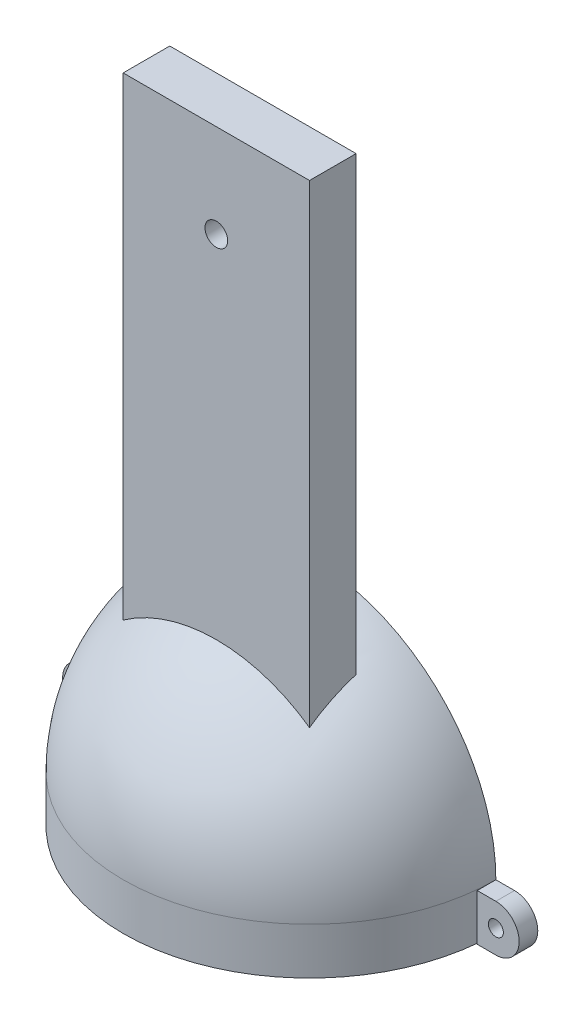
from build123d import *

# Parameters (mm, degrees)
REVOLVE2_ANGLE        = 90
BOSS_EXTRUDE2_DEPTH   = 5
BOSS_EXTRUDE3_DEPTH   = 2
BOSS_EXTRUDE3_2_DEPTH = 2
BOSS_EXTRUDE4_START   = 14.142136
SKETCH10_W            = 20
SKETCH10_H            = 5
BOSS_EXTRUDE4_DEPTH   = 50.857864
SKETCH11_R            = 5
BOSS_EXTRUDE6_DEPTH   = 5
SKETCH12_R            = 1.22
SKETCH12_R_2          = 0.805
CUT_EXTRUDE1_DEPTH    = 10


with BuildPart() as part:
    # Sketch1 → Revolve2 (revolve)
    with BuildSketch(Plane.XY):
        with BuildLine():
            Line((-20, 0), (-15, 0))
            ThreePointArc((-15, 0), (0, 15), (15, 0))
            Line((15, 0), (20, 0))
            ThreePointArc((20, 0), (0, 20), (-20, 0))
        make_face()
    revolve(axis=Axis((10, 0, 0), (1, 0, 0)), revolution_arc=REVOLVE2_ANGLE)

    # Sketch3 → Boss-Extrude2 (add)
    with BuildSketch(Plane.XZ):
        with BuildLine():
            Line((-20, 0), (-10, 0))
            ThreePointArc((-10, 0), (0, 10), (10, 0))
            Line((10, 0), (20, 0))
            ThreePointArc((20, 0), (0, 20), (-20, 0))
        make_face()
    extrude(amount=BOSS_EXTRUDE2_DEPTH)

    # Sketch10 → Boss-Extrude4 (add)
    with BuildSketch(Plane(origin=(0, 0, 0), x_dir=(1, 0, 0), z_dir=(0, 1, 0)).offset(BOSS_EXTRUDE4_START)):
        with Locations((0, -7.5)):
            Rectangle(SKETCH10_W, SKETCH10_H)
    extrude(amount=BOSS_EXTRUDE4_DEPTH)

    # Sketch11 → Boss-Extrude6 (add)
    with BuildSketch(Plane(origin=(0, 0, 5), x_dir=(-1, 0, 0), z_dir=(0, 0, -1))):
        with Locations(Location((0, 55, 0), (0, 0, 180))):
            Circle(SKETCH11_R)
    extrude(amount=BOSS_EXTRUDE6_DEPTH)


with BuildPart() as body_2:
    # Sketch5 → Boss-Extrude3 (new body)
    with BuildSketch(Plane(origin=(0, 0, 0), x_dir=(-1, 0, 0), z_dir=(0, 0, -1))):
        with BuildLine():
            Line((-22, 0), (-20, 0))
            Line((-20, 0), (-20, -5))
            Line((-20, -5), (-22, -5))
            ThreePointArc((-22, -5), (-24.5, -2.5), (-22, 0))
        make_face()
    extrude(amount=-BOSS_EXTRUDE3_DEPTH)


with BuildPart() as body_3:
    # Sketch5 → Boss-Extrude3 2 (new body)
    with BuildSketch(Plane(origin=(0, 0, 0), x_dir=(-1, 0, 0), z_dir=(0, 0, -1))):
        with BuildLine():
            Line((22, -5), (20, -5))
            Line((20, -5), (20, 0))
            Line((20, 0), (22, 0))
            ThreePointArc((22, 0), (24.5, -2.5), (22, -5))
        make_face()
    extrude(amount=-BOSS_EXTRUDE3_2_DEPTH)


with BuildPart() as cut_extrude1_tool:
    # Sketch12 → Cut-Extrude1 (new body)
    with BuildSketch(Plane(origin=(0, 0, 0), x_dir=(-1, 0, 0), z_dir=(0, 0, -1))):
        with Locations((0, 55)):
            Circle(SKETCH12_R)
        with Locations((-22, -2.5)):
            Circle(SKETCH12_R_2)
        with Locations((22, -2.5)):
            Circle(SKETCH12_R_2)
    extrude(amount=-CUT_EXTRUDE1_DEPTH)


with BuildPart() as part_1:
    add(part.part)

    # Cut-Extrude1: cut by cut_extrude1_tool
    add(cut_extrude1_tool.part, mode=Mode.SUBTRACT)


with BuildPart() as body_2_1:
    add(body_2.part)

    # Cut-Extrude1: cut by cut_extrude1_tool
    add(cut_extrude1_tool.part, mode=Mode.SUBTRACT)


with BuildPart() as body_3_1:
    add(body_3.part)

    # Cut-Extrude1: cut by cut_extrude1_tool
    add(cut_extrude1_tool.part, mode=Mode.SUBTRACT)


solid = Compound([part_1.part, body_2_1.part, body_3_1.part])
